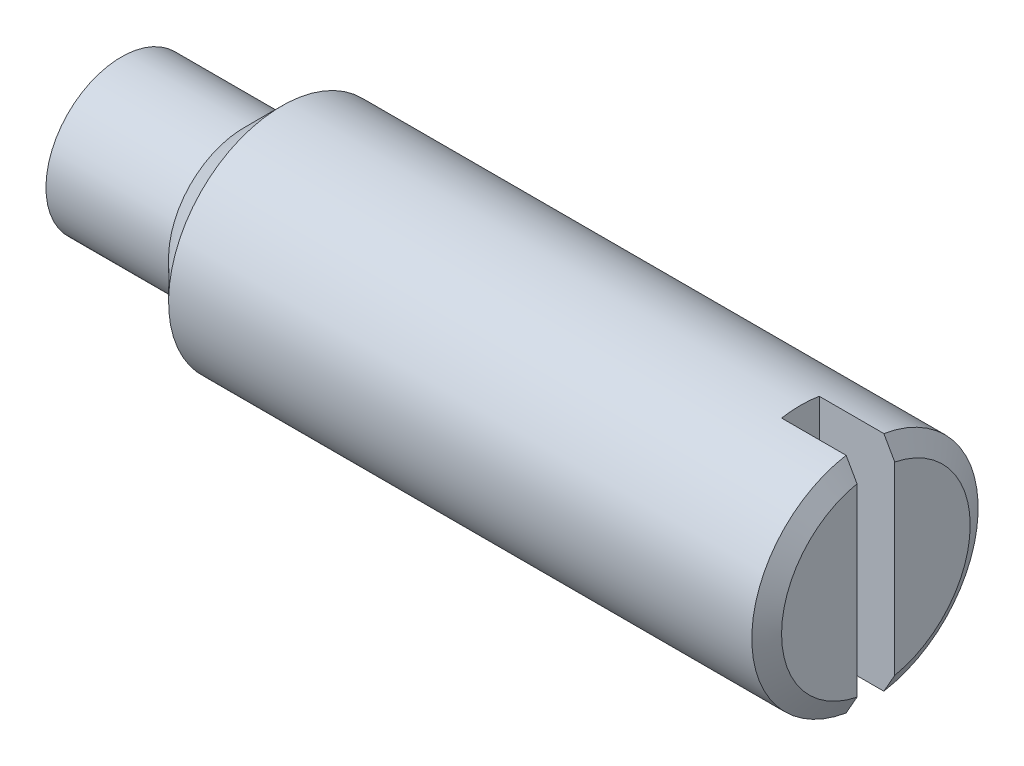
from build123d import *

# Parameters (mm, degrees)
CHAMFER1_SIZE      = 0.5
CHAMFER1_SIZE2     = 0.288675135
SKETCH2_W          = 1
SKETCH2_H          = 6
CUT_EXTRUDE2_DEPTH = 2


with BuildPart() as part:
    # Sketch1 → Revolve1 (revolve)
    with BuildSketch(Plane.XY, mode=Mode.PRIVATE) as revolve1_sk:
        Polygon((0, 0), (0, 3), (-15.75, 3), (-16.75, 2), (-20, 2), (-20, 0), align=None)
    revolve(revolve1_sk.sketch.rotate(Axis((-20, 0, 0), (1, 0, 0)), 180), axis=Axis((-20, 0, 0), (1, 0, 0)))

    # Chamfer1
    chamfer1_edges = [part.edges().sort_by_distance(p)[0] for p in [
        (0, 3, 0),
    ]]
    chamfer1_side = [part.faces().sort_by_distance(p)[0] for p in [
        (0, 0, 0),
    ]]
    chamfer(chamfer1_edges, length=CHAMFER1_SIZE, length2=CHAMFER1_SIZE2, reference=chamfer1_side[0])

    # Sketch2 → Cut-Extrude2 (cut)
    with BuildSketch(Plane(origin=(0, 0, 0), x_dir=(0, 0, -1), z_dir=(1, 0, 0))):
        Rectangle(SKETCH2_W, SKETCH2_H)
    extrude(amount=-CUT_EXTRUDE2_DEPTH, mode=Mode.SUBTRACT)


solid = part.part
